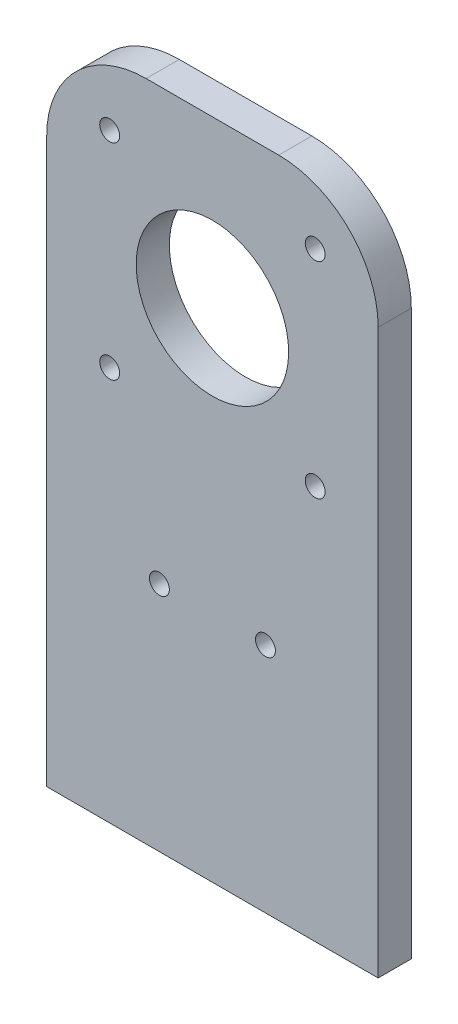
from build123d import *

# Parameters (mm, degrees)
SKETCH4_R           = 11.5
SKETCH4_R_2         = 1.5
BOSS_EXTRUDE1_DEPTH = 5


with BuildPart() as part:
    # Sketch4 → Boss-Extrude1 (new body)
    with BuildSketch(Plane.XY):
        with BuildLine():
            Line((-10.087403903, 107.088819702), (9.912596097, 107.088819702))
            ThreePointArc((9.912596097, 107.088819702), (20.519197815, 102.695421419), (24.912596097, 92.088819702))
            Line((24.912596097, 92.088819702), (24.912596097, 7.088819702))
            Line((24.912596097, 7.088819702), (-25.087403903, 7.088819702))
            Line((-25.087403903, 7.088819702), (-25.087403903, 92.088819702))
            ThreePointArc((-25.087403903, 92.088819702), (-20.694005621, 102.695421419), (-10.087403903, 107.088819702))
        make_face()
        with Locations((-0.087403903, 82.088819702)):
            Circle(SKETCH4_R, mode=Mode.SUBTRACT)
        with Locations((15.412596097, 66.588819702)):
            Circle(SKETCH4_R_2, mode=Mode.SUBTRACT)
        with Locations(Location((-15.587403903, 66.588819702, 0), (0, 0, 180))):
            Circle(SKETCH4_R_2, mode=Mode.SUBTRACT)
        with Locations(Location((15.412596097, 97.588819702, 0), (0, 0, 180))):
            Circle(SKETCH4_R_2, mode=Mode.SUBTRACT)
        with Locations((-15.587403903, 97.588819702)):
            Circle(SKETCH4_R_2, mode=Mode.SUBTRACT)
        with Locations((-8.087403903, 42.088819702)):
            Circle(SKETCH4_R_2, mode=Mode.SUBTRACT)
        with Locations(Location((7.912596097, 42.088819702, 0), (0, 0, 180))):
            Circle(SKETCH4_R_2, mode=Mode.SUBTRACT)
    extrude(amount=BOSS_EXTRUDE1_DEPTH)


solid = part.part
